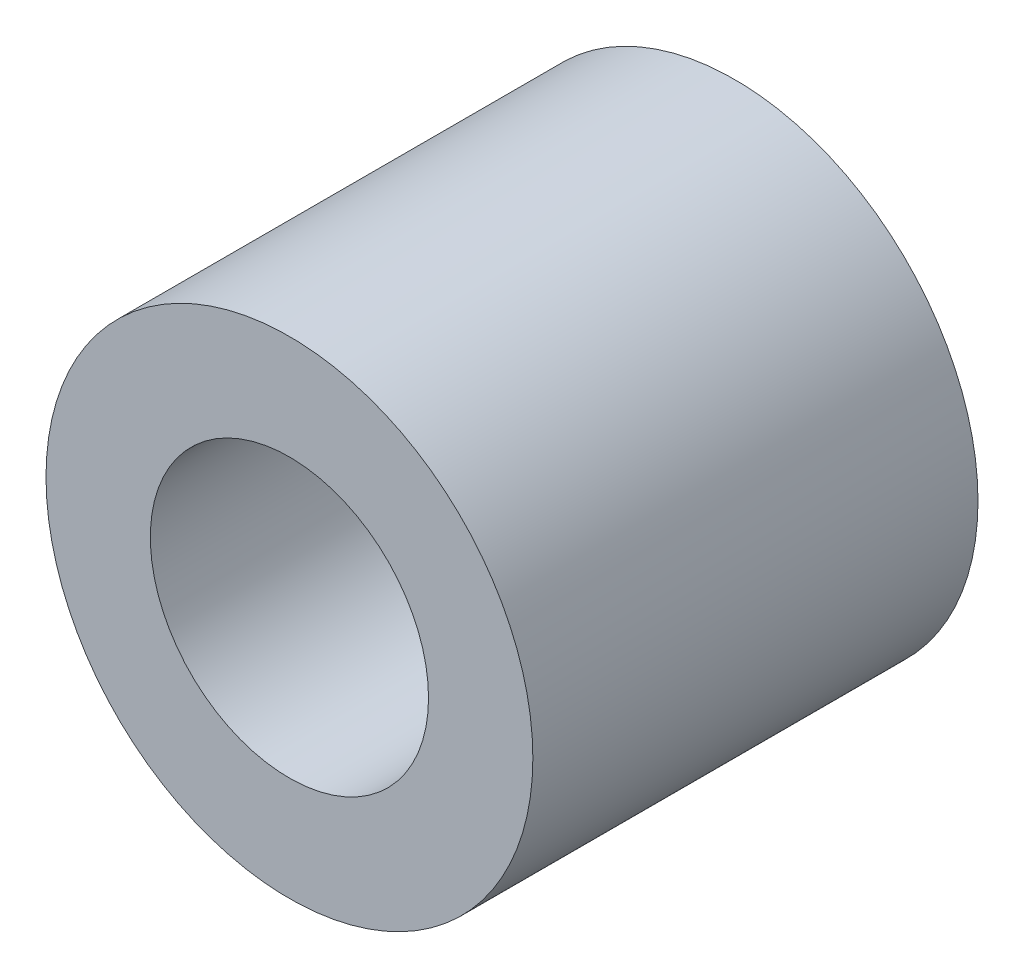
from build123d import *

# Parameters (mm, degrees)
SKETCH1_R           = 3.5
SKETCH1_R_2         = 2
BOSS_EXTRUDE1_DEPTH = 6.4


with BuildPart() as part:
    # Sketch1 → Boss-Extrude1 (new body)
    with BuildSketch(Plane.XY):
        Circle(SKETCH1_R)
        Circle(SKETCH1_R_2, mode=Mode.SUBTRACT)
    extrude(amount=BOSS_EXTRUDE1_DEPTH)


solid = part.part
